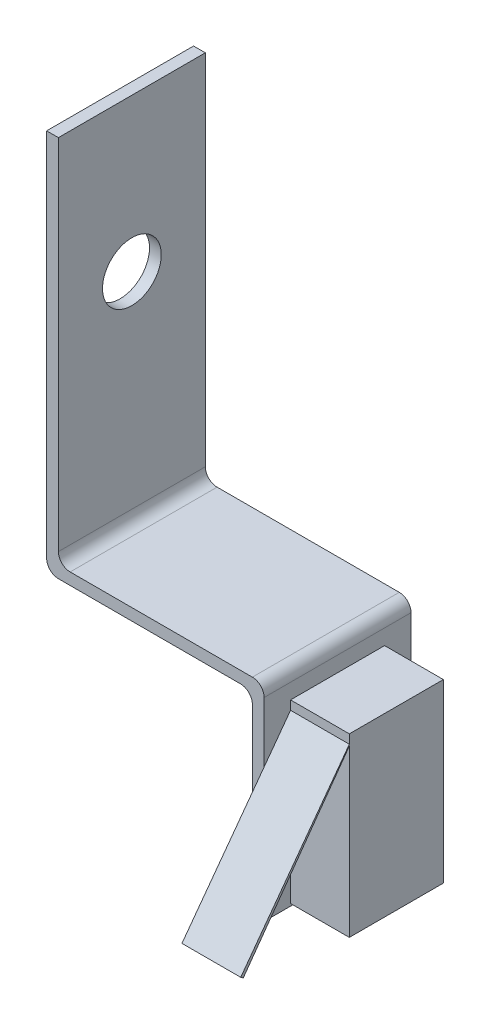
from build123d import *

# Parameters (mm, degrees)
BOSS_EXTRUDE1_DEPTH      = 12.5
BOSS_EXTRUDE1_DEPTH_BACK = 12.5
F_10_0MM_DOWEL_HOLE1_D   = 10
FILLET1_R                = 2
SKETCH3_W                = 16
SKETCH3_H                = 30
BOSS_EXTRUDE2_DEPTH      = 10
BOSS_EXTRUDE3_DEPTH      = 10


with BuildPart() as part:
    # Sketch1 → Boss-Extrude1 (new, two sides: drawn at the far end of the back side and taken through both)
    with BuildSketch(Plane.XY.offset(-BOSS_EXTRUDE1_DEPTH_BACK)):
        Polygon((0, 0), (2, 0), (2, -63), (37, -63), (37, -98), (35, -98), (35, -65), (0, -65), align=None)
    extrude(amount=BOSS_EXTRUDE1_DEPTH + BOSS_EXTRUDE1_DEPTH_BACK)

    # Ø10.0mm Dowel Hole1 (through all)
    with Locations(Plane(origin=(2, -26, 0), x_dir=(0, 1, 0), z_dir=(1, 0, 0))):
        with Locations((0, 0)):
            Hole(F_10_0MM_DOWEL_HOLE1_D / 2)

    # Fillet1
    fillet1_edges = [part.edges().sort_by_distance(p)[0] for p in [
        (35, -65, 0),
        (0, -65, 0),
        (2, -63, 0),
        (37, -63, 0),
    ]]
    fillet(fillet1_edges, radius=FILLET1_R)

    # Sketch3 → Boss-Extrude2 (add)
    with BuildSketch(Plane(origin=(37, 0, 0), x_dir=(0, 0, -1), z_dir=(1, 0, 0))):
        with Locations((0, -82.60435288)):
            Rectangle(SKETCH3_W, SKETCH3_H)
    extrude(amount=BOSS_EXTRUDE2_DEPTH)

    # Sketch4 → Boss-Extrude3 (add)
    with BuildSketch(Plane(origin=(47, 0, 0), x_dir=(0, 0, -1), z_dir=(1, 0, 0))):
        Polygon((-8, -69.135252509), (-26.480043417, -94.242566668), (-26.046645408, -94.559298491), (-8, -69.410399443), align=None)
    extrude(amount=-BOSS_EXTRUDE3_DEPTH)


solid = part.part
